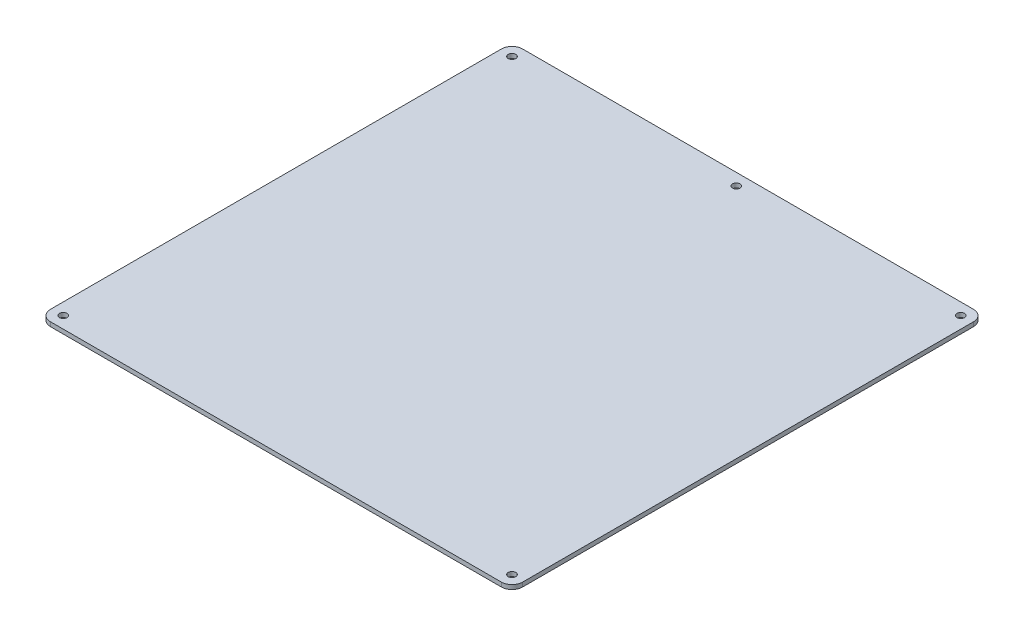
from build123d import *

# Parameters (mm, degrees)
SKETCH_1_R      = 1.75
EXTRUDE_1_DEPTH = 2


with BuildPart() as part:
    # Эскиз1 → Бобышка-Вытянуть1 (new body)
    with BuildSketch(Plane(origin=(0, 0, 0), x_dir=(1, 0, 0), z_dir=(0, 1, 0))):
        with BuildLine():
            Line((-105, 110), (105, 110))
            ThreePointArc((105, 110), (108.535533906, 108.535533906), (110, 105))
            Line((110, 105), (110, -105))
            ThreePointArc((110, -105), (108.535533906, -108.535533906), (105, -110))
            Line((105, -110), (-105, -110))
            ThreePointArc((-105, -110), (-108.535533906, -108.535533906), (-110, -105))
            Line((-110, -105), (-110, 105))
            ThreePointArc((-110, 105), (-108.535533906, 108.535533906), (-105, 110))
        make_face()
        with Locations(Location((104.5, 104.5, 0), (0, 0, 270))):
            Circle(SKETCH_1_R, mode=Mode.SUBTRACT)
        with Locations(Location((104.5, -104.5, 0), (0, 0, 270))):
            Circle(SKETCH_1_R, mode=Mode.SUBTRACT)
        with Locations(Location((0, 104.5, 0), (0, 0, 270))):
            Circle(SKETCH_1_R, mode=Mode.SUBTRACT)
        with Locations(Location((-104.5, 104.5, 0), (0, 0, 270))):
            Circle(SKETCH_1_R, mode=Mode.SUBTRACT)
        with Locations(Location((-104.5, -104.5, 0), (0, 0, 270))):
            Circle(SKETCH_1_R, mode=Mode.SUBTRACT)
    extrude(amount=EXTRUDE_1_DEPTH)


solid = part.part
